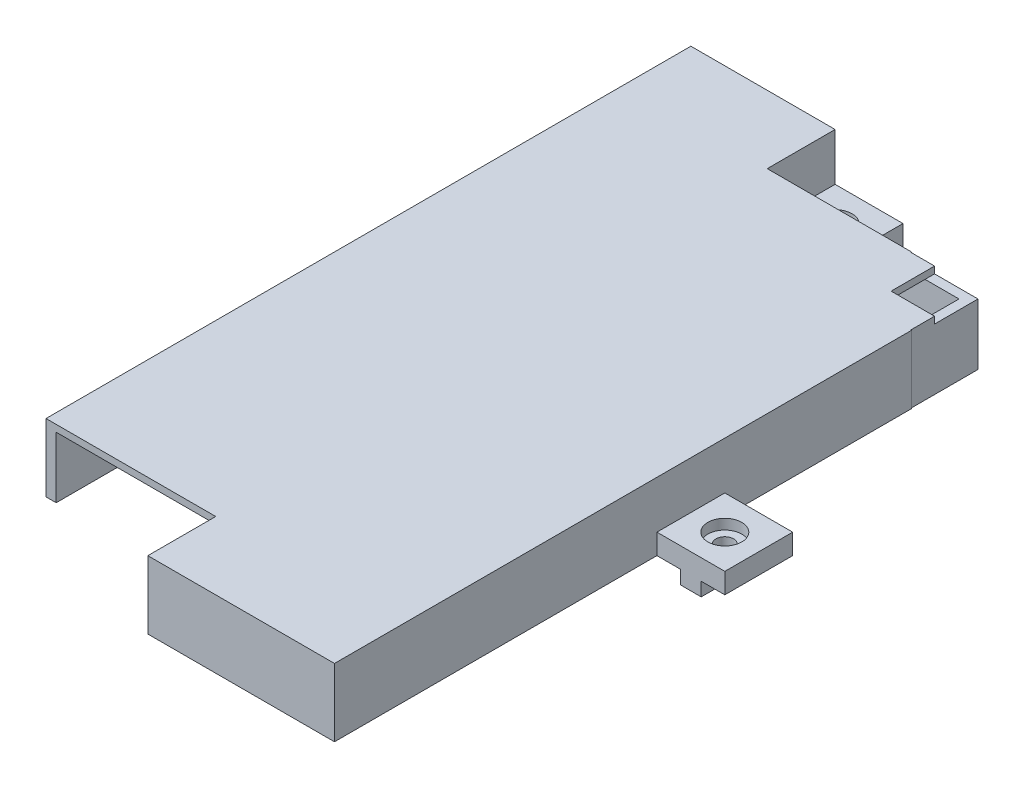
from build123d import *

# Parameters (mm, degrees)
SKETCH_1_W           = 105
SKETCH_1_H           = 170
EXTRUDE_1_DEPTH      = 2
SKETCH_2_W           = 23
SKETCH_2_H           = 20
EXTRUDE_2_DEPTH      = 20
SKETCH_3_W           = 20
SKETCH_3_H           = 20
CUT_EXTRUDE_1_DEPTH  = 14
SKETCH_4_R           = 2.6
CUT_EXTRUDE_2_DEPTH  = 14
SKETCH_5_R           = 5
CUT_EXTRUDE_3_DEPTH  = 3
SKETCH_6_W           = 3
SKETCH_6_H           = 75
EXTRUDE_3_DEPTH      = 18
SKETCH_7_W           = 102
SKETCH_7_H           = 3
EXTRUDE_4_DEPTH      = 18
SKETCH_8_W           = 20
SKETCH_8_H           = 20
EXTRUDE_5_DEPTH      = 6
SKETCH_9_R           = 2.6
CUT_EXTRUDE_4_DEPTH  = 6
SKETCH_10_R          = 5
CUT_EXTRUDE_5_DEPTH  = 3
SKETCH_11_W          = 6.1
SKETCH_11_H          = 6.95
EXTRUDE_6_DEPTH      = 4
SKETCH_12_W          = 6.95
SKETCH_12_H          = 6.1
EXTRUDE_7_DEPTH      = 4
SKETCH_13_W          = 55
SKETCH_13_H          = 3
EXTRUDE_8_DEPTH      = 20
SKETCH_14_W          = 20
SKETCH_14_H          = 20
CUT_EXTRUDE_6_DEPTH  = 2
SKETCH_15_W          = 42.5
SKETCH_15_H          = 20
EXTRUDE_9_DEPTH      = 20
SKETCH_16_R          = 6
CUT_EXTRUDE_7_DEPTH  = 30
CUT_EXTRUDE_9_DEPTH  = 30
CUT_EXTRUDE_10_DEPTH = 30
EXTRUDE_17_DEPTH     = 2
CUT_EXTRUDE_11_DEPTH = 5
SKETCH_25_W          = 52
SKETCH_25_H          = 3
CUT_EXTRUDE_12_DEPTH = 18
SKETCH_26_W          = 105
SKETCH_26_H          = 20
EXTRUDE_18_DEPTH     = 2
EXTRUDE_19_DEPTH     = 18
SKETCH_28_W          = 50
SKETCH_28_H          = 20
CUT_EXTRUDE_13_DEPTH = 18
SKETCH_29_W          = 3
SKETCH_29_H          = 167
EXTRUDE_20_DEPTH     = 18
SKETCH_30_R          = 2.5
SKETCH_30_R_2        = 1.48
EXTRUDE_21_DEPTH     = 10
SKETCH_31_R          = 1.48
EXTRUDE_22_DEPTH     = 2
EXTRUDE_24_DEPTH     = 18


with BuildPart() as part:
    # 草图1 → 凸台-拉伸1 (new body)
    with BuildSketch(Plane(origin=(0, 0, 0), x_dir=(1, 0, 0), z_dir=(0, 1, 0))):
        with Locations((52.5, 85)):
            Rectangle(SKETCH_1_W, SKETCH_1_H)
    extrude(amount=EXTRUDE_1_DEPTH)

    # 草图2 → 凸台-拉伸2 (add)
    with BuildSketch(Plane(origin=(0, 2, 0), x_dir=(1, 0, 0), z_dir=(0, 1, 0))):
        with Locations((113.5, 85)):
            Rectangle(SKETCH_2_W, SKETCH_2_H)
    extrude(amount=-EXTRUDE_2_DEPTH)

    # 草图3 → 切除-拉伸1 (cut)
    with BuildSketch(Plane(origin=(0, 2, 0), x_dir=(1, 0, 0), z_dir=(0, 1, 0))):
        with Locations((115, 85)):
            Rectangle(SKETCH_3_W, SKETCH_3_H)
    extrude(amount=-CUT_EXTRUDE_1_DEPTH, mode=Mode.SUBTRACT)

    # 草图4 → 切除-拉伸2 (cut)
    with BuildSketch(Plane(origin=(0, -12, 0), x_dir=(1, 0, 0), z_dir=(0, 1, 0))):
        with Locations((115, 85)):
            Circle(SKETCH_4_R)
    extrude(amount=-CUT_EXTRUDE_2_DEPTH, mode=Mode.SUBTRACT)

    # 草图5 → 切除-拉伸3 (cut)
    with BuildSketch(Plane(origin=(0, -12, 0), x_dir=(1, 0, 0), z_dir=(0, 1, 0))):
        with Locations((115, 85)):
            Circle(SKETCH_5_R)
    extrude(amount=-CUT_EXTRUDE_3_DEPTH, mode=Mode.SUBTRACT)

    # 草图6 → 凸台-拉伸3 (add)
    with BuildSketch(Plane.XZ):
        with Locations((103.5, -132.5)):
            Rectangle(SKETCH_6_W, SKETCH_6_H)
        with Locations((103.5, -37.5)):
            Rectangle(SKETCH_6_W, SKETCH_6_H)
    extrude(amount=EXTRUDE_3_DEPTH)

    # 草图7 → 凸台-拉伸4 (add)
    with BuildSketch(Plane(origin=(0, 0, 0), x_dir=(-1, 0, 0), z_dir=(0, -1, 0))):
        with Locations((-51, 168.5)):
            Rectangle(SKETCH_7_W, SKETCH_7_H)
    extrude(amount=EXTRUDE_4_DEPTH)

    # 草图8 → 凸台-拉伸5 (add)
    with BuildSketch(Plane(origin=(0, -18, 0), x_dir=(-1, 0, 0), z_dir=(0, -1, 0))):
        with Locations((-52.5, 180)):
            Rectangle(SKETCH_8_W, SKETCH_8_H)
    extrude(amount=-EXTRUDE_5_DEPTH)

    # 草图9 → 切除-拉伸4 (cut)
    with BuildSketch(Plane(origin=(0, -12, 0), x_dir=(1, 0, 0), z_dir=(0, 1, 0))):
        with Locations((52.5, 180)):
            Circle(SKETCH_9_R)
    extrude(amount=-CUT_EXTRUDE_4_DEPTH, mode=Mode.SUBTRACT)

    # 草图10 → 切除-拉伸5 (cut)
    with BuildSketch(Plane(origin=(0, -12, 0), x_dir=(1, 0, 0), z_dir=(0, 1, 0))):
        with Locations((52.5, 180)):
            Circle(SKETCH_10_R)
    extrude(amount=-CUT_EXTRUDE_5_DEPTH, mode=Mode.SUBTRACT)

    # 草图11 → 凸台-拉伸6 (add)
    with BuildSketch(Plane.XZ.offset(18)):
        with Locations((115, -78.475)):
            Rectangle(SKETCH_11_W, SKETCH_11_H)
        with Locations((115, -91.525)):
            Rectangle(SKETCH_11_W, SKETCH_11_H)
    extrude(amount=EXTRUDE_6_DEPTH)

    # 草图12 → 凸台-拉伸7 (add)
    with BuildSketch(Plane(origin=(0, -18, 0), x_dir=(-1, 0, 0), z_dir=(0, -1, 0))):
        with Locations((-59.025, 180)):
            Rectangle(SKETCH_12_W, SKETCH_12_H)
        with Locations((-45.975, 180)):
            Rectangle(SKETCH_12_W, SKETCH_12_H)
    extrude(amount=EXTRUDE_7_DEPTH)

    # 草图13 → 凸台-拉伸8 (add)
    with BuildSketch(Plane(origin=(0, 2, 0), x_dir=(1, 0, 0), z_dir=(0, 1, 0))):
        with Locations((77.5, 1.5)):
            Rectangle(SKETCH_13_W, SKETCH_13_H)
    extrude(amount=-EXTRUDE_8_DEPTH)

    # 草图14 → 切除-拉伸6 (cut)
    with BuildSketch(Plane(origin=(0, 2, 0), x_dir=(1, 0, 0), z_dir=(0, 1, 0))):
        with Locations((95, 160)):
            Rectangle(SKETCH_14_W, SKETCH_14_H)
    extrude(amount=-CUT_EXTRUDE_6_DEPTH, mode=Mode.SUBTRACT)

    # 草图15 → 凸台-拉伸9 (add)
    with BuildSketch(Plane.XZ.offset(18)):
        with Locations((21.25, -180)):
            Rectangle(SKETCH_15_W, SKETCH_15_H)
    extrude(amount=-EXTRUDE_9_DEPTH)

    # 草图16 → 切除-拉伸7 (cut)
    with BuildSketch(Plane(origin=(0, 0, -190), x_dir=(-1, 0, 0), z_dir=(0, 0, -1))):
        with Locations((-10, -8)):
            Circle(SKETCH_16_R)
    extrude(amount=-CUT_EXTRUDE_7_DEPTH, mode=Mode.SUBTRACT)

    # 草图17 → 切除-拉伸9 (cut)
    with BuildSketch(Plane(origin=(0, 0, -190), x_dir=(-1, 0, 0), z_dir=(0, 0, -1))):
        Polygon((-22.75, -4.5), (-29.25, -4.5), (-35.75, -4.5), (-35.75, -11.5), (-29.25, -11.5), (-22.75, -11.5), align=None)
    extrude(amount=-CUT_EXTRUDE_9_DEPTH, mode=Mode.SUBTRACT)

    # 草图19 → 切除-拉伸10 (cut)
    with BuildSketch(Plane(origin=(0, 0, 0), x_dir=(1, 0, 0), z_dir=(0, 1, 0))):
        Polygon((105, 150), (105, 170), (85, 170), (85, 169.8), (104.8, 169.8), (104.8, 150), align=None)
    extrude(amount=-CUT_EXTRUDE_10_DEPTH, mode=Mode.SUBTRACT)

    # 草图21 → 凸台-拉伸17 (add)
    with BuildSketch(Plane(origin=(0, 2, 0), x_dir=(1, 0, 0), z_dir=(0, 1, 0))):
        Polygon((102, 157), (92, 157), (92, 167), (92, 169.8), (85, 169.8), (85, 167), (85, 150), (102, 150), (104.8, 150), (104.8, 157), align=None)
    extrude(amount=-EXTRUDE_17_DEPTH)

    # 草图23 → 切除-拉伸11 (cut)
    with BuildSketch(Plane(origin=(0, 0, -190), x_dir=(-1, 0, 0), z_dir=(0, 0, -1))):
        Polygon((-22.75, -11.5), (-22.75, -14), (-35.75, -14), (-35.75, -2), (-22.75, -2), align=None)
    extrude(amount=-CUT_EXTRUDE_11_DEPTH, mode=Mode.SUBTRACT)

    # 草图25 → 切除-拉伸12 (cut)
    with BuildSketch(Plane(origin=(0, -18, 0), x_dir=(-1, 0, 0), z_dir=(0, -1, 0))):
        with Locations((-76, 1.5)):
            Rectangle(SKETCH_25_W, SKETCH_25_H)
    extrude(amount=-CUT_EXTRUDE_12_DEPTH, mode=Mode.SUBTRACT)

    # 草图26 → 凸台-拉伸18 (add)
    with BuildSketch(Plane(origin=(0, 2, 0), x_dir=(1, 0, 0), z_dir=(0, 1, 0))):
        with Locations((52.5, -10)):
            Rectangle(SKETCH_26_W, SKETCH_26_H)
    extrude(amount=-EXTRUDE_18_DEPTH)

    # 草图27 → 凸台-拉伸19 (add)
    with BuildSketch(Plane(origin=(0, 0, 0), x_dir=(-1, 0, 0), z_dir=(0, -1, 0))):
        Polygon((-102, -17), (-102, 0), (-105, 0), (-105, -20), (-50, -20), (-50, -17), align=None)
    extrude(amount=EXTRUDE_19_DEPTH)

    # 草图28 → 切除-拉伸13 (cut)
    with BuildSketch(Plane.XZ):
        with Locations((25, 10)):
            Rectangle(SKETCH_28_W, SKETCH_28_H)
    extrude(amount=-CUT_EXTRUDE_13_DEPTH, mode=Mode.SUBTRACT)

    # 草图29 → 凸台-拉伸20 (add)
    with BuildSketch(Plane(origin=(0, 0, 0), x_dir=(-1, 0, 0), z_dir=(0, -1, 0))):
        with Locations((-1.5, 83.5)):
            Rectangle(SKETCH_29_W, SKETCH_29_H)
    extrude(amount=EXTRUDE_20_DEPTH)

    # 草图30 → 凸台-拉伸21 (add)
    # profile 1 of 4: a face of its own
    with BuildSketch(Plane.XZ):
        with Locations((23.5, -24.5)):
            Circle(SKETCH_30_R)
        with Locations((23.5, -24.5)):
            Circle(SKETCH_30_R_2, mode=Mode.SUBTRACT)
    # profile 2 of 4: a face of its own
    with BuildSketch(Plane.XZ):
        with Locations((81.5, -24.5)):
            Circle(SKETCH_30_R)
        with Locations((81.5, -24.5)):
            Circle(SKETCH_30_R_2, mode=Mode.SUBTRACT)
    # profile 3 of 4: a face of its own
    with BuildSketch(Plane.XZ):
        with Locations((81.5, -73.5)):
            Circle(SKETCH_30_R)
        with Locations((81.5, -73.5)):
            Circle(SKETCH_30_R_2, mode=Mode.SUBTRACT)
    # profile 4 of 4: a face of its own
    with BuildSketch(Plane.XZ):
        with Locations((23.5, -73.5)):
            Circle(SKETCH_30_R)
        with Locations((23.5, -73.5)):
            Circle(SKETCH_30_R_2, mode=Mode.SUBTRACT)
    extrude(amount=EXTRUDE_21_DEPTH)

    # 草图31 → 凸台-拉伸22 (add)
    with BuildSketch(Plane.XZ):
        with Locations((23.5, -24.5)):
            Circle(SKETCH_31_R)
        with Locations((81.5, -24.5)):
            Circle(SKETCH_31_R)
        with Locations((81.5, -73.5)):
            Circle(SKETCH_31_R)
        with Locations((23.5, -73.5)):
            Circle(SKETCH_31_R)
    extrude(amount=EXTRUDE_22_DEPTH)

    # 草图33 → 凸台-拉伸24 (add)
    with BuildSketch(Plane.XZ):
        Polygon((27.5, -97), (52.5, -97), (77.5, -97), (77.5, -94), (27.5, -94), align=None)
    extrude(amount=EXTRUDE_24_DEPTH)


solid = part.part
